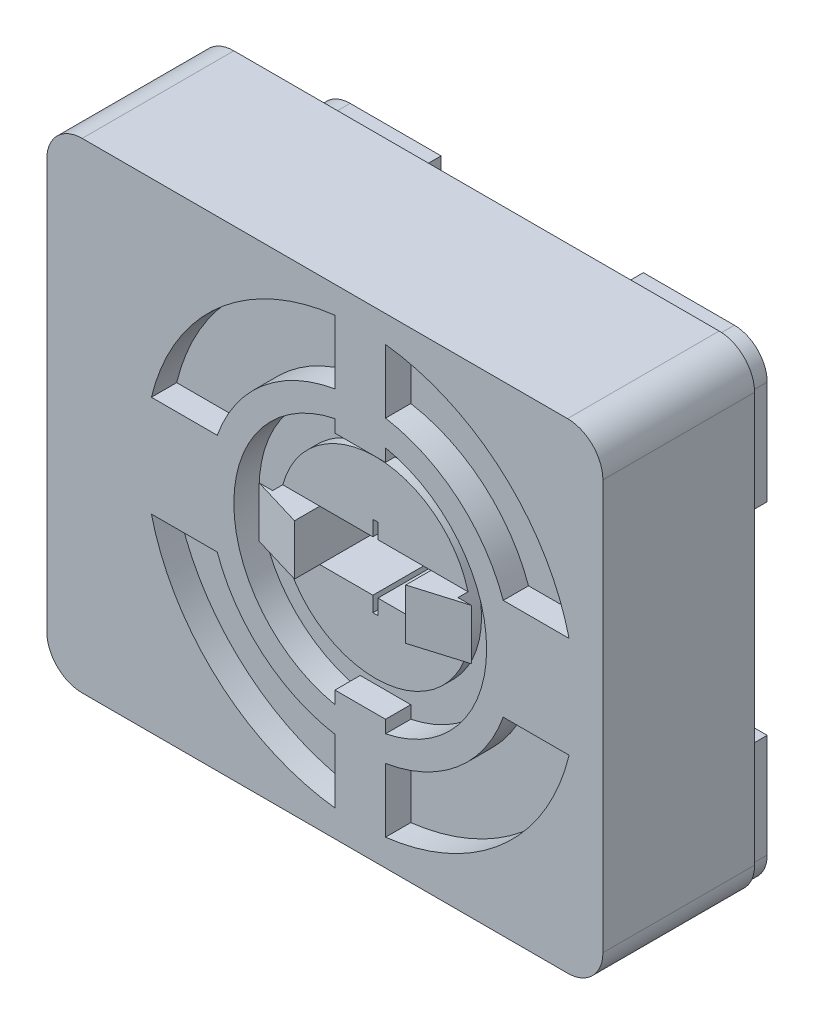
from build123d import *

# Parameters (mm, degrees)
SKETCH_1_W          = 11
SKETCH_1_H          = 9.5
EXTRUDE_1_DEPTH     = 3
CUT_EXTRUDE_1_DEPTH = 0.5
FILLET_1_R          = 0.7
SKETCH_3_R          = 1.9
EXTRUDE_2_DEPTH     = 0.2
CUT_EXTRUDE_2_DEPTH = 15.783098457
EXTRUDE_3_DEPTH     = 0.2
EXTRUDE_4_DEPTH     = 1
SKETCH_7_R          = 0.75
EXTRUDE_5_DEPTH     = 0.5
SKETCH_8_R          = 0.75
SKETCH_8_R_2        = 2
EXTRUDE_6_DEPTH     = 0.3


with BuildPart() as part:
    # 草图1 → 凸台-拉伸1 (new body)
    with BuildSketch(Plane.XY):
        with Locations((5.5, 4.75)):
            Rectangle(SKETCH_1_W, SKETCH_1_H)
    extrude(amount=EXTRUDE_1_DEPTH)

    # 草图2 → 切除-拉伸1 (cut)
    with BuildSketch(Plane.XY.offset(3)):
        with BuildLine():
            Line((9.028427125, 5.75), (10.33067791, 5.75))
            ThreePointArc((10.33067791, 5.75), (9.020226339, 7.929437592), (6.7, 8.970485754))
            Line((6.7, 8.970485754), (6.7, 7.708039892))
            ThreePointArc((6.7, 7.708039892), (8.130825429, 7.046064713), (9.028427125, 5.75))
        make_face()
        with BuildLine():
            Line((3.371572875, 3.75), (2.06932209, 3.75))
            ThreePointArc((2.06932209, 3.75), (3.379773661, 1.570562408), (5.7, 0.529514246))
            Line((5.7, 0.529514246), (5.7, 1.791960108))
            ThreePointArc((5.7, 1.791960108), (4.269174571, 2.453935287), (3.371572875, 3.75))
        make_face()
        with BuildLine():
            Line((2.06932209, 5.75), (3.371572875, 5.75))
            ThreePointArc((3.371572875, 5.75), (4.269174571, 7.046064713), (5.7, 7.708039892))
            Line((5.7, 7.708039892), (5.7, 8.970485754))
            ThreePointArc((5.7, 8.970485754), (3.379773661, 7.929437592), (2.06932209, 5.75))
        make_face()
        with BuildLine():
            Line((10.33067791, 3.75), (9.028427125, 3.75))
            ThreePointArc((9.028427125, 3.75), (8.130825429, 2.453935287), (6.7, 1.791960108))
            Line((6.7, 1.791960108), (6.7, 0.529514246))
            ThreePointArc((6.7, 0.529514246), (9.020226339, 1.570562408), (10.33067791, 3.75))
        make_face()
        with BuildLine():
            Line((5.7, 7.199489743), (5.7, 6.95))
            Line((5.7, 6.95), (6.7, 6.95))
            Line((6.7, 6.95), (6.7, 7.199489743))
            ThreePointArc((6.7, 7.199489743), (8.7, 4.75), (6.7, 2.300510257))
            Line((6.7, 2.300510257), (6.7, 2.55))
            Line((6.7, 2.55), (5.7, 2.55))
            Line((5.7, 2.55), (5.7, 2.300510257))
            ThreePointArc((5.7, 2.300510257), (3.7, 4.75), (5.7, 7.199489743))
        make_face()
    extrude(amount=-CUT_EXTRUDE_1_DEPTH, mode=Mode.SUBTRACT)

    # 圆角1
    fillet_1_edges = [part.edges().sort_by_distance(p)[0] for p in [
        (0, 0, 1.5),
        (0, 9.5, 1.5),
        (11, 9.5, 1.5),
        (11, 0, 1.5),
    ]]
    fillet(fillet_1_edges, radius=FILLET_1_R)

    # 草图3 → 凸台-拉伸2 (add)
    with BuildSketch(Plane.XY.offset(2.5)):
        with Locations((6.2, 4.75)):
            Circle(SKETCH_3_R)
    extrude(amount=EXTRUDE_2_DEPTH)

    # 草图4 → 切除-拉伸2 (cut, through all)
    with BuildSketch(Plane.XY.offset(2.7)):
        Polygon((6.15, 5.55), (6.25, 5.55), (6.25, 5.25), (7.3, 5.25), (7.3, 4.25), (6.25, 4.25), (6.25, 3.95), (6.15, 3.95), (6.15, 4.25), (5.1, 4.25), (5.1, 4.75), (5.1, 5.25), (6.15, 5.25), align=None)
    extrude(amount=-CUT_EXTRUDE_2_DEPTH, mode=Mode.SUBTRACT)

    # 草图5 → 凸台-拉伸3 (add)
    with BuildSketch(Plane.XY.offset(2.7)):
        with BuildLine():
            Line((5.1, 4.25), (5.1, 5.25))
            Line((5.1, 5.25), (4.366969722, 5.25))
            ThreePointArc((4.366969722, 5.25), (4.3, 4.75), (4.366969722, 4.25))
            Line((4.366969722, 4.25), (5.1, 4.25))
        make_face()
        with BuildLine():
            Line((7.3, 5.25), (8.033030278, 5.25))
            ThreePointArc((8.033030278, 5.25), (8.1, 4.75), (8.033030278, 4.25))
            Line((8.033030278, 4.25), (7.3, 4.25))
            Line((7.3, 4.25), (7.3, 5.25))
        make_face()
    extrude(amount=EXTRUDE_3_DEPTH)

    # 草图6 → 凸台-拉伸4 (add)
    with BuildSketch(Plane.XZ.offset(-4.25)):
        Polygon((5.1, 2.9), (5.1, 3.2), (4.1, 2.9), align=None)
        Polygon((7.3, 2.9), (7.3, 3.2), (8.3, 2.9), align=None)
    extrude(amount=-EXTRUDE_4_DEPTH)

    # 草图7 → 凸台-拉伸5 (add)
    with BuildSketch(Plane(origin=(0, 0, 0), x_dir=(-1, 0, 0), z_dir=(0, 0, -1))):
        with Locations((-10, 8.5)):
            Circle(SKETCH_7_R)
        with Locations((-3, 8.5)):
            Circle(SKETCH_7_R)
        with Locations((-3, 1)):
            Circle(SKETCH_7_R)
        with Locations((-10, 1)):
            Circle(SKETCH_7_R)
    extrude(amount=EXTRUDE_5_DEPTH)

    # 草图8 → 凸台-拉伸6 (add)
    with BuildSketch(Plane(origin=(0, 0, 0), x_dir=(-1, 0, 0), z_dir=(0, 0, -1))):
        with BuildLine():
            Line((-2.05, 0.7), (-2.05, 2.75))
            Line((-2.05, 2.75), (-2.55, 2.75))
            Line((-2.55, 2.75), (-2.55, 4.75))
            Line((-2.55, 4.75), (-2.55, 6.75))
            Line((-2.55, 6.75), (-2.05, 6.75))
            Line((-2.05, 6.75), (-2.05, 8.8))
            ThreePointArc((-2.05, 8.8), (-2.240380592, 9.259619408), (-2.7, 9.45))
            Line((-2.7, 9.45), (-4.5, 9.45))
            Line((-4.5, 9.45), (-4.5, 8.95))
            Line((-4.5, 8.95), (-6.5, 8.95))
            Line((-6.5, 8.95), (-8.5, 8.95))
            Line((-8.5, 8.95), (-8.5, 9.45))
            Line((-8.5, 9.45), (-10.3, 9.45))
            ThreePointArc((-10.3, 9.45), (-10.759619408, 9.259619408), (-10.95, 8.8))
            Line((-10.95, 8.8), (-10.95, 6.75))
            Line((-10.95, 6.75), (-10.45, 6.75))
            Line((-10.45, 6.75), (-10.45, 4.75))
            Line((-10.45, 4.75), (-10.45, 2.75))
            Line((-10.45, 2.75), (-10.95, 2.75))
            Line((-10.95, 2.75), (-10.95, 0.7))
            ThreePointArc((-10.95, 0.7), (-10.759619408, 0.240380592), (-10.3, 0.05))
            Line((-10.3, 0.05), (-8.5, 0.05))
            Line((-8.5, 0.05), (-8.5, 0.55))
            Line((-8.5, 0.55), (-7.5, 0.55))
            Line((-7.5, 0.55), (-6.5, 0.55))
            Line((-6.5, 0.55), (-4.5, 0.55))
            Line((-4.5, 0.55), (-4.5, 0.05))
            Line((-4.5, 0.05), (-2.7, 0.05))
            ThreePointArc((-2.7, 0.05), (-2.240380592, 0.240380592), (-2.05, 0.7))
        make_face()
        with Locations(Location((-10, 8.5, 0), (0, 0, 180))):
            Circle(SKETCH_8_R, mode=Mode.SUBTRACT)
        with Locations(Location((-3, 8.5, 0), (0, 0, 180))):
            Circle(SKETCH_8_R, mode=Mode.SUBTRACT)
        with Locations(Location((-10, 1, 0), (0, 0, 180))):
            Circle(SKETCH_8_R, mode=Mode.SUBTRACT)
        with Locations(Location((-3, 1, 0), (0, 0, 180))):
            Circle(SKETCH_8_R, mode=Mode.SUBTRACT)
        with Locations((-6.2, 4.75)):
            Circle(SKETCH_8_R_2, mode=Mode.SUBTRACT)
    extrude(amount=EXTRUDE_6_DEPTH)


solid = part.part
